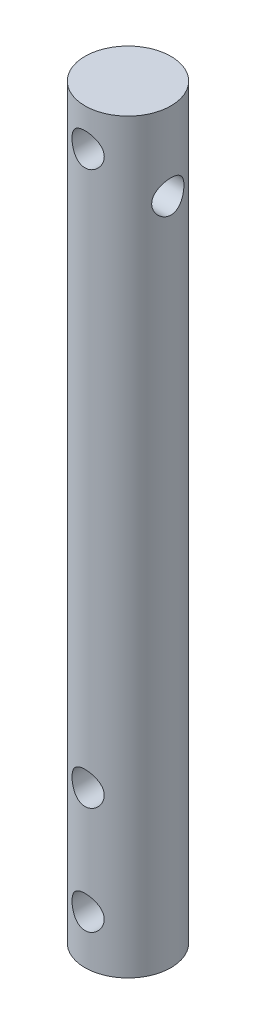
from build123d import *

# Parameters (mm, degrees)
SKETCH1_R               = 4
BOSS_EXTRUDE1_DEPTH     = 69.5
CUT_EXTRUDE1_DEPTH      = 79.218588868
CUT_EXTRUDE1_DEPTH_BACK = 79.218588868
SKETCH2_R               = 1.5
CUT_EXTRUDE2_DEPTH      = 70.729835906
CUT_EXTRUDE2_DEPTH_BACK = 70.729835906
SKETCH3_R               = 1.5
CUT_EXTRUDE3_DEPTH      = 70.729835906
CUT_EXTRUDE3_DEPTH_BACK = 70.729835906
SKETCH4_R               = 1.5


with BuildPart() as part:
    # Sketch1 → Boss-Extrude1 (new body)
    with BuildSketch(Plane(origin=(0, 0, 0), x_dir=(1, 0, 0), z_dir=(0, 1, 0))):
        with Locations(Location((0, 0, 0), (0, 0, 270))):
            Circle(SKETCH1_R)
    extrude(amount=BOSS_EXTRUDE1_DEPTH)

    # Sketch2 → Cut-Extrude1 (cut, two sides: drawn at the far end of the back side and taken through both)
    with BuildSketch(Plane(origin=(-34.800875944, 1.701477372, 0), x_dir=(1, 0, 0), z_dir=(0, 0, 1)).offset(-CUT_EXTRUDE1_DEPTH_BACK)):
        with Locations(Location((34.800875944, 2.798522628, 0), (0, 0, 90.000000025))):
            Circle(SKETCH2_R)
        with Locations(Location((34.800875944, 12.798522628, 0), (0, 0, 90.000000025))):
            Circle(SKETCH2_R)
    extrude(amount=CUT_EXTRUDE1_DEPTH + CUT_EXTRUDE1_DEPTH_BACK, mode=Mode.SUBTRACT)

    # Sketch3 → Cut-Extrude2 (cut, two sides: drawn at the far end of the back side and taken through both)
    with BuildSketch(Plane.XY.offset(-CUT_EXTRUDE2_DEPTH_BACK)):
        with Locations(Location((0, 66, 0), (0, 0, 90.000000025))):
            Circle(SKETCH3_R)
    extrude(amount=CUT_EXTRUDE2_DEPTH + CUT_EXTRUDE2_DEPTH_BACK, mode=Mode.SUBTRACT)

    # Sketch4 → Cut-Extrude3 (cut, two sides: drawn at the far end of the back side and taken through both)
    with BuildSketch(Plane(origin=(0, 0, 0), x_dir=(0, 0, -1), z_dir=(1, 0, 0)).offset(-CUT_EXTRUDE3_DEPTH_BACK)):
        with Locations((0, 62.2)):
            Circle(SKETCH4_R)
    extrude(amount=CUT_EXTRUDE3_DEPTH + CUT_EXTRUDE3_DEPTH_BACK, mode=Mode.SUBTRACT)


solid = part.part
